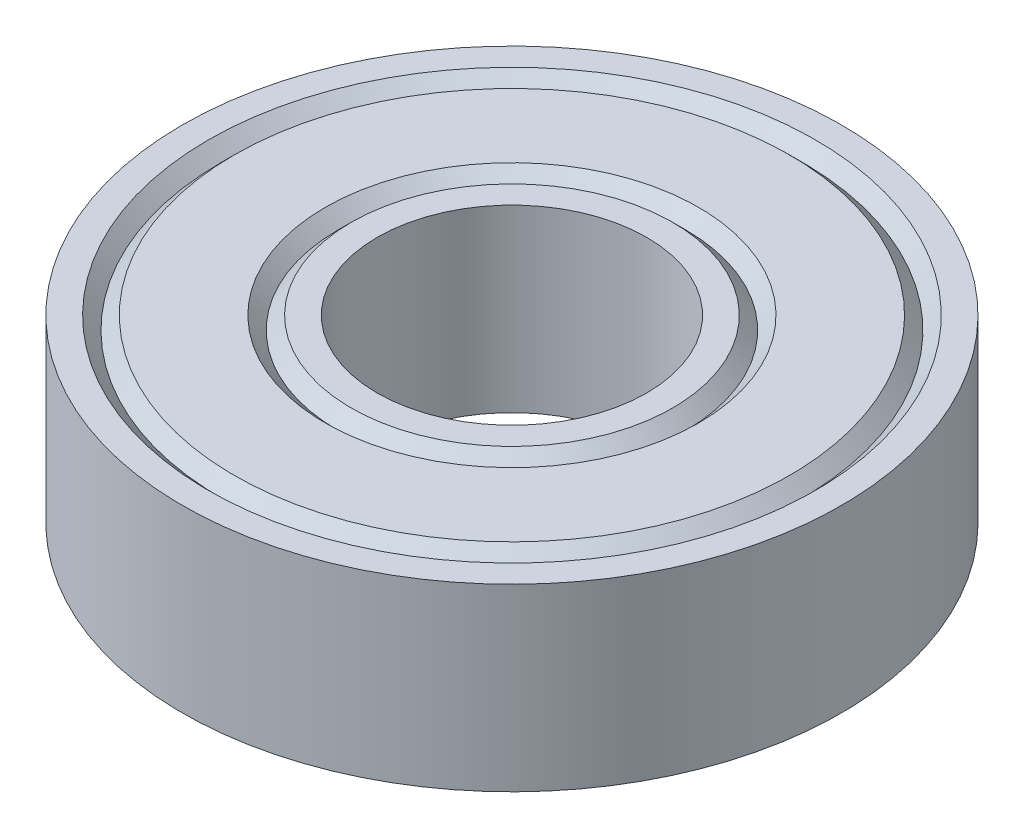
from build123d import *


with BuildPart() as part:
    # Sketch1 → Revolve1 (revolve)
    with BuildSketch(Plane.XY):
        Polygon((-4.5, 3), (-5.366666667, 3), (-5.8, 2.566666667), (-6.233333333, 3), (-9.266666667, 3), (-9.7, 2.566666667), (-10.133333333, 3), (-11, 3), (-11, -3), (-10.133333333, -3), (-9.7, -2.566666667), (-9.266666667, -3), (-6.233333333, -3), (-5.8, -2.566666667), (-5.366666667, -3), (-4.5, -3), align=None)
    revolve(axis=Axis((0, 3, 0), (0, -1, 0)))


solid = part.part
